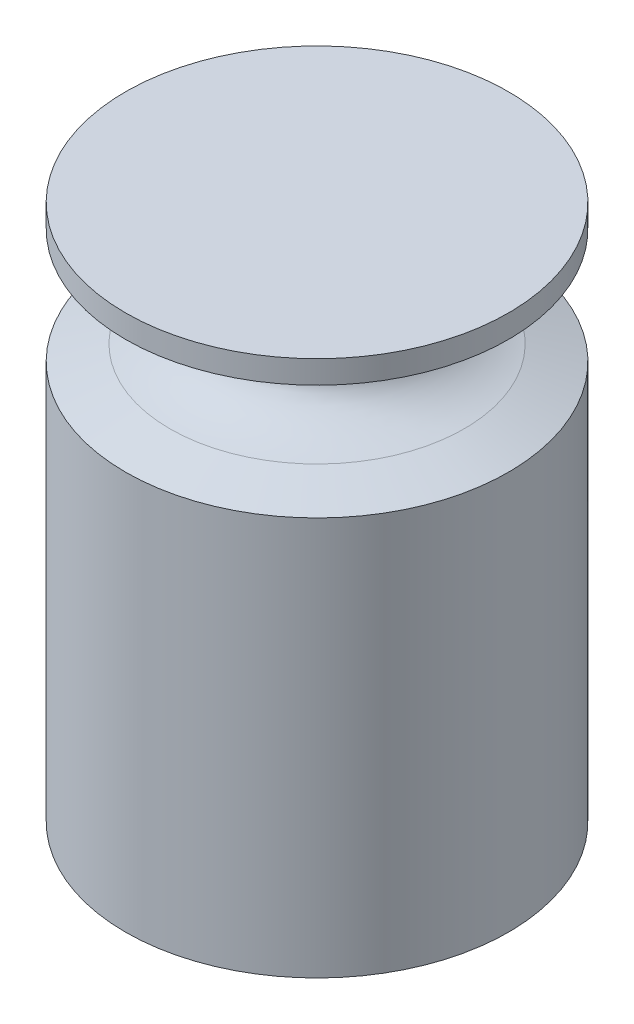
from build123d import *

# Parameters (mm, degrees)
SKETCH1_R           = 25
BOSS_EXTRUDE1_DEPTH = 70


with BuildPart() as part:
    # Sketch1 → Boss-Extrude1 (new body)
    with BuildSketch(Plane(origin=(0, 0, 0), x_dir=(1, 0, 0), z_dir=(0, 1, 0))):
        with Locations(Location((0, 0, 0), (0, 0, 270))):
            Circle(SKETCH1_R)
    extrude(amount=BOSS_EXTRUDE1_DEPTH)

    # Sketch2 → Cut-Revolve3 (revolve, cut)
    with BuildSketch(Plane.XY, mode=Mode.PRIVATE) as cut_revolve3_sk:
        with BuildLine():
            Line((-25, 67), (-19.206969312, 65))
            add(Edge.make_bspline(
                [(-19.206969312, 65), (-10.627743926, 62.513316988), (-9.9009432, 56.486683012), (-19.206969312, 54)],
                knots=[0, 0, 0, 0, 1, 1, 1, 1], degree=3))
            Line((-19.206969312, 54), (-25, 52))
            Line((-25, 52), (-25, 67))
        make_face()
    revolve(cut_revolve3_sk.sketch.rotate(Axis((0, 70, 0), (0, -1, 0)), 270), axis=Axis((0, 70, 0), (0, -1, 0)), mode=Mode.SUBTRACT)


solid = part.part
